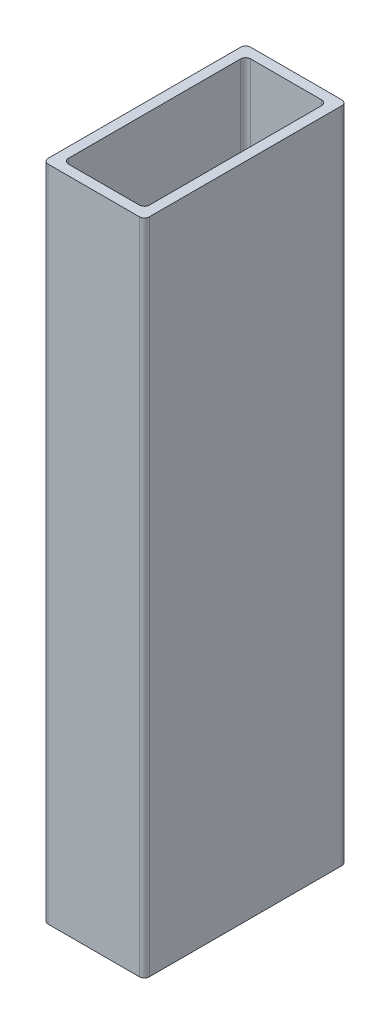
from build123d import *

# Parameters (mm, degrees)
BOSS_EXTRU_1_DEPTH = 260


with BuildPart() as part:
    # Esquisse2 → Boss.-Extru.1 (new body)
    with BuildSketch(Plane(origin=(0, 0, 0), x_dir=(1, 0, 0), z_dir=(0, 1, 0))):
        with BuildLine():
            Line((2, 0), (38, 0))
            ThreePointArc((38, 0), (39.414213562, 0.585786438), (40, 2))
            Line((40, 2), (40, 78))
            ThreePointArc((40, 78), (39.414213562, 79.414213562), (38, 80))
            Line((38, 80), (2, 80))
            ThreePointArc((2, 80), (0.585786438, 79.414213562), (0, 78))
            Line((0, 78), (0, 2))
            ThreePointArc((0, 2), (0.585786438, 0.585786438), (2, 0))
        make_face()
        with BuildLine():
            Line((6, 4), (34, 4))
            ThreePointArc((34, 4), (35.414213562, 4.585786438), (36, 6))
            Line((36, 6), (36, 74))
            ThreePointArc((36, 74), (35.414213562, 75.414213562), (34, 76))
            Line((34, 76), (6, 76))
            ThreePointArc((6, 76), (4.585786438, 75.414213562), (4, 74))
            Line((4, 74), (4, 6))
            ThreePointArc((4, 6), (4.585786438, 4.585786438), (6, 4))
        make_face(mode=Mode.SUBTRACT)
    extrude(amount=BOSS_EXTRU_1_DEPTH)


solid = part.part
